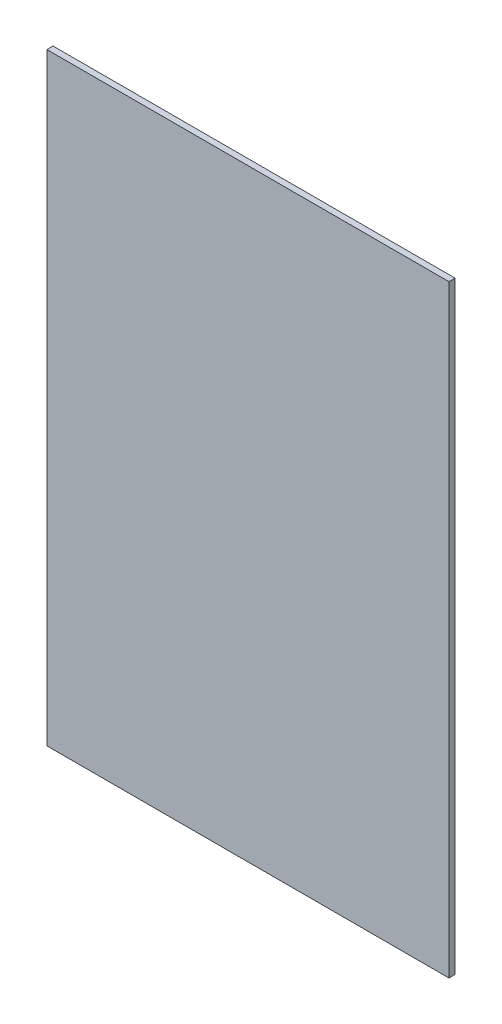
from build123d import *

# Parameters (mm, degrees)
SKETCH1_W      = 100
SKETCH1_H      = 150
EXTRUDE1_DEPTH = 1.524


with BuildPart() as part:
    # Sketch1 → Extrude1 (new body)
    with BuildSketch(Plane.XY):
        Rectangle(SKETCH1_W, SKETCH1_H)
    extrude(amount=EXTRUDE1_DEPTH)


solid = part.part
